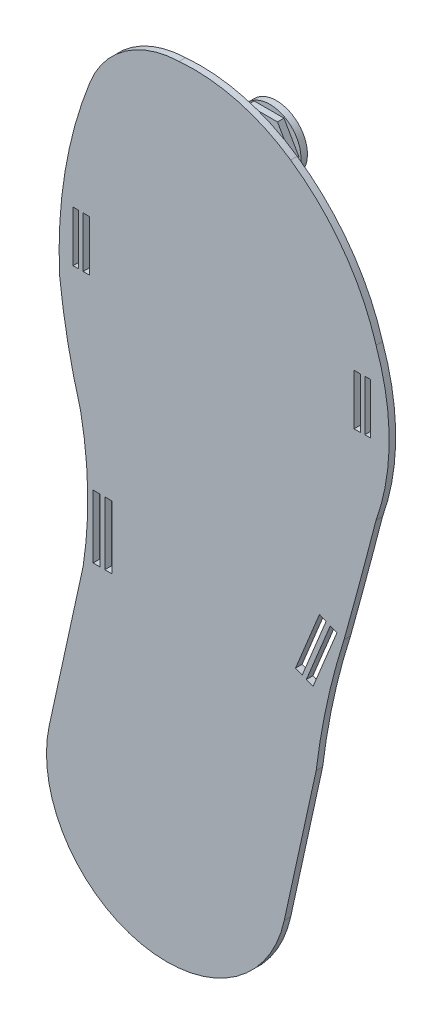
from build123d import *

# Parameters (mm, degrees)
BOSS_EXTRUDE1_DEPTH = 10
SKETCH3_W           = 9.565213244
SKETCH3_H           = 77.966410476
SKETCH3_W_2         = 8.353543979
SKETCH3_H_2         = 77.966410475
CUT_EXTRUDE1_DEPTH  = 250
SKETCH4_W           = 11
SKETCH4_H           = 97
CUT_EXTRUDE2_DEPTH  = 250
SKETCH5_R           = 25
BOSS_EXTRUDE2_DEPTH = 120
BOSS_EXTRUDE3_DEPTH = 10
SKETCH10_R          = 47.687508242
BOSS_EXTRUDE4_DEPTH = 10


with BuildPart() as part:
    # Sketch1 → Boss-Extrude1 (new body)
    with BuildSketch(Plane.XY):
        with BuildLine():
            Line((-51.984126252, 392.74957316), (0, 630.098149599))
            ThreePointArc((0, 630.098149599), (7.08288491, 733.363548715), (-3.984096645, 836.278231013))
            ThreePointArc((-3.984096645, 836.278231013), (-23.520457502, 916.694909006), (-36.012597338, 998.502353272))
            ThreePointArc((-36.012597338, 998.502353272), (-27.83897086, 1141.608720593), (10.535208392, 1279.716153066))
            ThreePointArc((10.535208392, 1279.716153066), (64.625002116, 1348.250843062), (147.435292888, 1375.912463775))
            ThreePointArc((147.435292888, 1375.912463775), (237.109169245, 1368.171524242), (318.838797646, 1330.467491469))
            ThreePointArc((318.838797646, 1330.467491469), (399.875156257, 1251.203752857), (450.033178317, 1149.548430819))
            ThreePointArc((450.033178317, 1149.548430819), (470.234397487, 1033.122029824), (450.033178317, 916.695628829))
            ThreePointArc((450.033178317, 916.695628829), (425.902967507, 824.914102712), (400.908098576, 733.364268538))
            ThreePointArc((400.908098576, 733.364268538), (374.881556851, 636.564375255), (358.063754215, 537.74756632))
            Line((358.063754215, 537.74756632), (308.99038073, 313.688874225))
            ThreePointArc((308.99038073, 313.688874225), (88.972777771, 172.731970202), (-51.984126252, 392.74957316))
        make_face()
    extrude(amount=BOSS_EXTRUDE1_DEPTH)

    # Sketch3 → Cut-Extrude1 (cut)
    with BuildSketch(Plane(origin=(0, 0, 0), x_dir=(-1, 0, 0), z_dir=(0, 0, -1))):
        with Locations((-4.782606622, 1061.735695438)):
            Rectangle(SKETCH3_W, SKETCH3_H)
        with Locations((11.17677199, 1061.735695438)):
            Rectangle(SKETCH3_W_2, SKETCH3_H)
        with Locations((-437.019311557, 1060.877248381)):
            Rectangle(SKETCH3_W_2, SKETCH3_H_2)
        with Locations((-421.059932945, 1060.448024852)):
            Rectangle(SKETCH3_W, SKETCH3_H_2)
    extrude(amount=-CUT_EXTRUDE1_DEPTH, mode=Mode.SUBTRACT)

    # Sketch4 → Cut-Extrude2 (cut)
    with BuildSketch(Plane(origin=(0, 0, 0), x_dir=(-1, 0, 0), z_dir=(0, 0, -1))):
        with Locations((-38.83297081, 691.059824561)):
            Rectangle(SKETCH4_W, SKETCH4_H)
        with Locations((-20.83297081, 691.059824561)):
            Rectangle(SKETCH4_W, SKETCH4_H)
        Polygon((-363.124216695, 747.966415693), (-326.394029606, 658.189506878), (-336.574916173, 654.024227929), (-373.305103262, 743.801136745), align=None)
        Polygon((-389.952232486, 736.954664741), (-353.222045397, 647.177755926), (-343.041158831, 651.343034874), (-379.77134592, 741.119943689), align=None)
    extrude(amount=-CUT_EXTRUDE2_DEPTH, mode=Mode.SUBTRACT)

    # Sketch5 → Boss-Extrude2 (add)
    with BuildSketch(Plane(origin=(0, 0, 0), x_dir=(-1, 0, 0), z_dir=(0, 0, -1))):
        with Locations(Location((-145.68729474, 1201.328438708, 0), (0, 0, 180))):
            Circle(SKETCH5_R)
    extrude(amount=BOSS_EXTRUDE2_DEPTH)

    # Sketch6 → Boss-Extrude3 (add)
    with BuildSketch(Plane(origin=(0, 0, -120), x_dir=(-1, 0, 0), z_dir=(0, 0, -1))):
        Polygon((-99.823082616, 1201.328438708), (-122.755188678, 1241.048011532), (-168.619400802, 1241.048011532), (-191.551506864, 1201.328438708), (-168.619400802, 1161.608865884), (-122.755188678, 1161.608865884), align=None)
    extrude(amount=BOSS_EXTRUDE3_DEPTH)

    # Sketch10 → Boss-Extrude4 (add)
    with BuildSketch(Plane(origin=(0, 0, -130), x_dir=(-1, 0, 0), z_dir=(0, 0, -1))):
        with Locations((-146.996021508, 1200.961482621)):
            Circle(SKETCH10_R)
    extrude(amount=BOSS_EXTRUDE4_DEPTH)


solid = part.part
